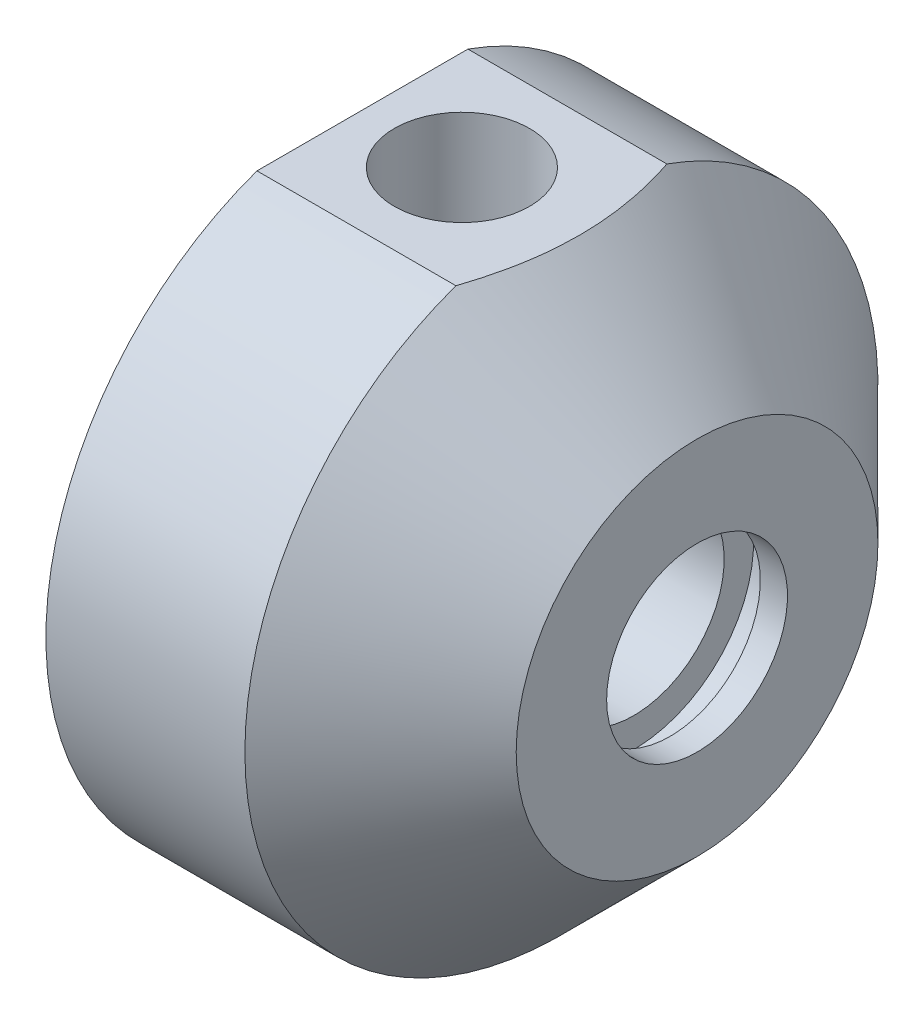
from build123d import *

# Parameters (mm, degrees)
ESQUISSE2_W                  = 51
ESQUISSE2_H                  = 6
ENL_V_MAT_EXTRU_1_DEPTH      = 25
ENL_V_MAT_EXTRU_2_REACH      = 82.777
ESQUISSE3_R                  = 7.475
ESQUISSE4_R                  = 3
ENL_V_MAT_EXTRU_3_DEPTH      = 20
R_P_TITION_CIRCULAIRE1_COUNT = 4
ESQUISSE7_R                  = 3
ENL_V_MAT_EXTRU_5_DEPTH      = 11
ENL_V_MAT_EXTRU_6_REACH      = 75.362
ESQUISSE8_R                  = 1


with BuildPart() as part:
    # Esquisse1 → Base-Révolution (revolve)
    with BuildSketch(Plane.XY, mode=Mode.PRIVATE) as base_r_volution_sk:
        Polygon((-26, 16), (-26, 20), (-23, 20), (-23, 18.5), (-20.4, 18.5), (-20.4, 20), (-16, 20), (-16, 35), (6, 35), (21, 20), (21, 10), (18, 10), (18, 13.25), (14, 13.25), (14, 10), (3.732050808, 10), (2, 13), (-23, 13), align=None)
    revolve(base_r_volution_sk.sketch.rotate(Axis((-21, 0, 0), (1, 0, 0)), 90), axis=Axis((-21, 0, 0), (1, 0, 0)))

    # Esquisse2 → Enlèv. mat.-Extru.1 (cut, symmetric)
    with BuildSketch(Plane.XY):
        with Locations((-5.5, 36)):
            Rectangle(ESQUISSE2_W, ESQUISSE2_H)
    extrude(amount=ENL_V_MAT_EXTRU_1_DEPTH, both=True, mode=Mode.SUBTRACT)

    # Esquisse3 → Enlèv. mat.-Extru.2 (cut, up to next)
    with BuildSketch(Plane(origin=(0, 33, 0), x_dir=(-1, 0, 0), z_dir=(0, 1, 0)), mode=Mode.PRIVATE) as enl_v_mat_extru_2_sk1:
        with Locations(Location((5, 0, 0), (0, 0, 90))):
            Circle(ESQUISSE3_R)
    enl_v_mat_extru_2_tool1 = extrude(enl_v_mat_extru_2_sk1.sketch, amount=-ENL_V_MAT_EXTRU_2_REACH, mode=Mode.PRIVATE) & part.part
    add(enl_v_mat_extru_2_tool1.solids().sort_by_distance((-5, 33, 0))[0], mode=Mode.SUBTRACT)

    # Esquisse4 → Enlèv. mat.-Extru.3 (cut)
    with BuildSketch(Plane.ZY.offset(16)):
        with Locations((19.798989873, -19.798989873)):
            Circle(ESQUISSE4_R)
    enl_v_mat_extru_3 = extrude(amount=-ENL_V_MAT_EXTRU_3_DEPTH, mode=Mode.SUBTRACT)

    # Répétition circulaire1: Enlèv. mat.-Extru.3 ×4 about axis
    r_p_tition_circulaire1_axis = Axis((-21, 0, 0), (1, 0, 0))
    for i in range(1, R_P_TITION_CIRCULAIRE1_COUNT):
        add(enl_v_mat_extru_3.rotate(r_p_tition_circulaire1_axis, i * 360 / R_P_TITION_CIRCULAIRE1_COUNT), mode=Mode.SUBTRACT)

    # Esquisse7 → Enlèv. mat.-Extru.5 (cut)
    with BuildSketch(Plane.XY.offset(-35)):
        with Locations(Location((-5, 0.349567503, 0), (0, 0, 180))):
            Circle(ESQUISSE7_R)
    extrude(amount=ENL_V_MAT_EXTRU_5_DEPTH, mode=Mode.SUBTRACT)

    # Esquisse8 → Enlèv. mat.-Extru.6 (cut, up to next)
    with BuildSketch(Plane(origin=(0, 0, -24), x_dir=(-1, 0, 0), z_dir=(0, 0, -1)), mode=Mode.PRIVATE) as enl_v_mat_extru_6_sk1:
        with Locations((5, 0.349567503)):
            Circle(ESQUISSE8_R)
    enl_v_mat_extru_6_tool1 = extrude(enl_v_mat_extru_6_sk1.sketch, amount=-ENL_V_MAT_EXTRU_6_REACH, mode=Mode.PRIVATE) & part.part
    add(enl_v_mat_extru_6_tool1.solids().sort_by_distance((-5, 0.349568, -24))[0], mode=Mode.SUBTRACT)


solid = part.part
